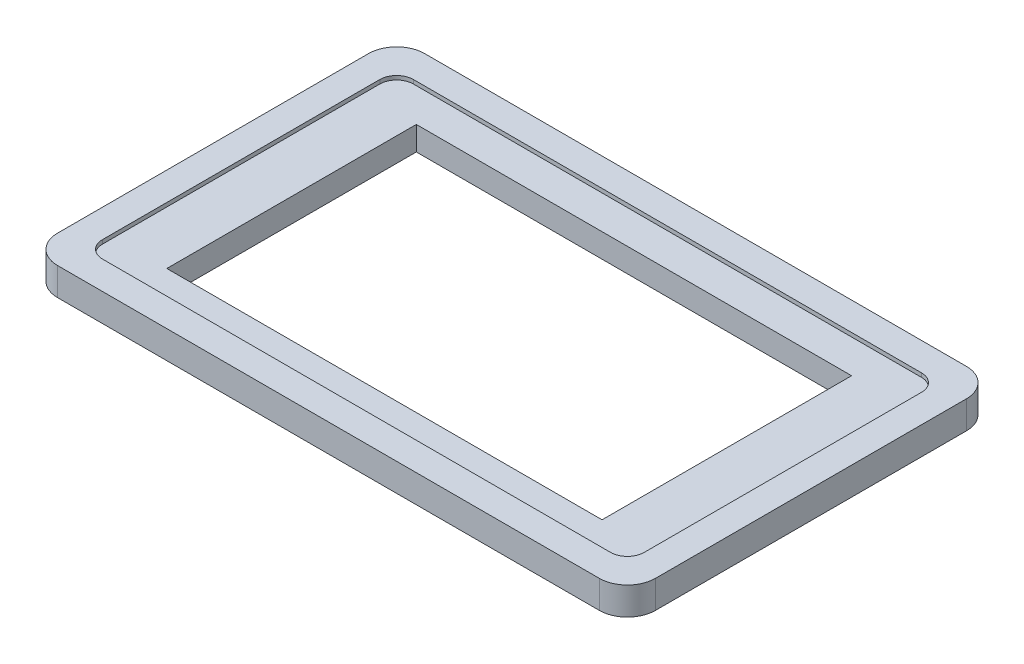
from build123d import *

# Parameters (mm, degrees)
BOSS_EXTRUDE1_DEPTH = 1.4
BOSS_EXTRUDE2_START = -8.5
FRONT_FACE_3_W      = 155.03
FRONT_FACE_3_H      = 88.87
BOSS_EXTRUDE2_DEPTH = 8.5


with BuildPart() as part:
    # Front Face → Boss-Extrude1 (new body)
    with BuildSketch(Plane(origin=(0, 0, 0), x_dir=(1, 0, 0), z_dir=(0, 1, 0))):
        with BuildLine():
            ThreePointArc((0, 10), (2.928932188, 2.928932188), (10, 0))
            Line((10, 0), (202.96, 0))
            ThreePointArc((202.96, 0), (210.031067812, 2.928932188), (212.96, 10))
            Line((212.96, 10), (212.96, 120.76))
            ThreePointArc((212.96, 120.76), (210.031067812, 127.831067812), (202.96, 130.76))
            Line((202.96, 130.76), (10, 130.76))
            ThreePointArc((10, 130.76), (2.928932188, 127.831067812), (0, 120.76))
            Line((0, 120.76), (0, 10))
        make_face()
        with BuildLine():
            Line((196.96, 10), (16, 10))
            ThreePointArc((16, 10), (11.757359313, 11.757359313), (10, 16))
            Line((10, 16), (10, 114.76))
            ThreePointArc((10, 114.76), (11.757359313, 119.002640687), (16, 120.76))
            Line((16, 120.76), (196.96, 120.76))
            ThreePointArc((196.96, 120.76), (201.202640687, 119.002640687), (202.96, 114.76))
            Line((202.96, 114.76), (202.96, 16))
            ThreePointArc((202.96, 16), (201.202640687, 11.757359313), (196.96, 10))
        make_face(mode=Mode.SUBTRACT)
    extrude(amount=BOSS_EXTRUDE1_DEPTH)

    # Front Face<3> → Boss-Extrude2 (add)
    with BuildSketch(Plane(origin=(0, 0, 0), x_dir=(1, 0, 0), z_dir=(0, 1, 0)).offset(BOSS_EXTRUDE2_START)):
        with BuildLine():
            ThreePointArc((0, 10), (2.928932188, 2.928932188), (10, 0))
            Line((10, 0), (202.96, 0))
            ThreePointArc((202.96, 0), (210.031067812, 2.928932188), (212.96, 10))
            Line((212.96, 10), (212.96, 120.76))
            ThreePointArc((212.96, 120.76), (210.031067812, 127.831067812), (202.96, 130.76))
            Line((202.96, 130.76), (10, 130.76))
            ThreePointArc((10, 130.76), (2.928932188, 127.831067812), (0, 120.76))
            Line((0, 120.76), (0, 10))
        make_face()
        with Locations((106.48, 64.38)):
            Rectangle(FRONT_FACE_3_W, FRONT_FACE_3_H, mode=Mode.SUBTRACT)
    extrude(amount=BOSS_EXTRUDE2_DEPTH)


solid = part.part
